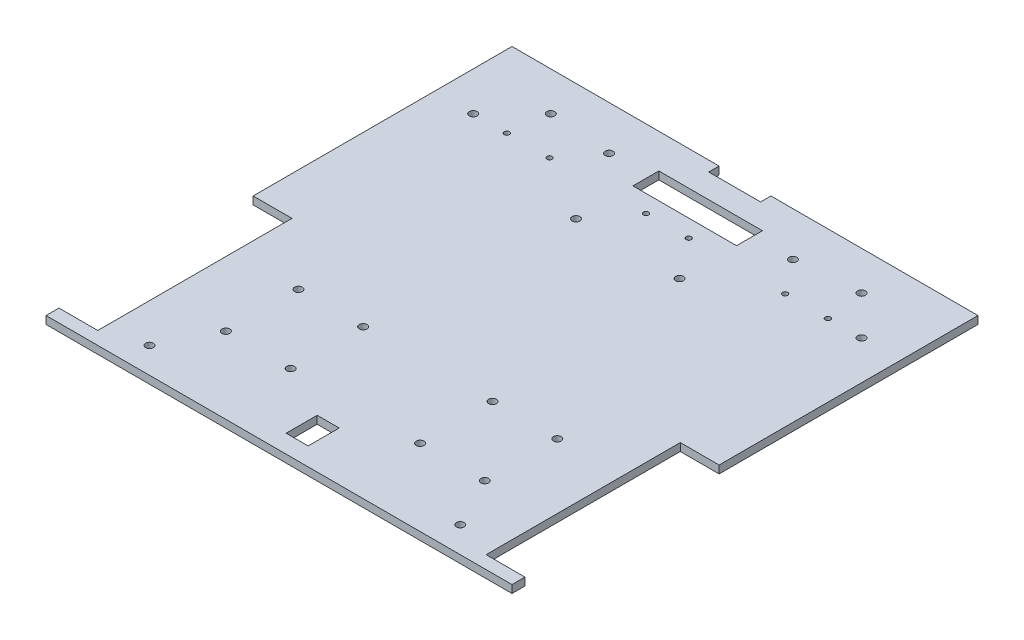
from build123d import *

# Parameters (mm, degrees)
SKETCH1_W           = 180
SKETCH1_H           = 180
BOSS_EXTRUDE1_DEPTH = 3
SKETCH2_W           = 15
SKETCH2_H           = 75
CUT_EXTRUDE1_DEPTH  = 3
SKETCH3_R           = 1.5
SKETCH3_R_2         = 1
SKETCH3_W           = 40
SKETCH3_H           = 10
CUT_EXTRUDE2_DEPTH  = 3
SKETCH5_R           = 1.5
CUT_EXTRUDE3_DEPTH  = 3
SKETCH7_W           = 20
SKETCH7_H           = 4
CUT_EXTRUDE4_DEPTH  = 3
SKETCH8_W           = 8.5
SKETCH8_H           = 12
CUT_EXTRUDE5_DEPTH  = 3


with BuildPart() as part:
    # Sketch1 → Boss-Extrude1 (new body)
    with BuildSketch(Plane(origin=(0, 0, 0), x_dir=(1, 0, 0), z_dir=(0, 1, 0))):
        Rectangle(SKETCH1_W, SKETCH1_H)
    extrude(amount=BOSS_EXTRUDE1_DEPTH)

    # Sketch2 → Cut-Extrude1 (cut)
    with BuildSketch(Plane(origin=(0, 3, 0), x_dir=(1, 0, 0), z_dir=(0, 1, 0))):
        with Locations((-82.5, -47.5)):
            Rectangle(SKETCH2_W, SKETCH2_H)
        with Locations((82.5, -47.5)):
            Rectangle(SKETCH2_W, SKETCH2_H)
    extrude(amount=-CUT_EXTRUDE1_DEPTH, mode=Mode.SUBTRACT)

    # Sketch3 → Cut-Extrude2 (cut)
    with BuildSketch(Plane(origin=(0, 3, 0), x_dir=(1, 0, 0), z_dir=(0, 1, 0))):
        with Locations(Location((-50, -32.5, 0), (0, 0, 270))):
            Circle(SKETCH3_R)
        with Locations(Location((-50, -60.5, 0), (0, 0, 270))):
            Circle(SKETCH3_R)
        with Locations(Location((-25, -32.5, 0), (0, 0, 270))):
            Circle(SKETCH3_R)
        with Locations(Location((-25, -60.5, 0), (0, 0, 270))):
            Circle(SKETCH3_R)
        with Locations(Location((25, -60.5, 0), (0, 0, 90))):
            Circle(SKETCH3_R)
        with Locations(Location((50, -60.5, 0), (0, 0, 90))):
            Circle(SKETCH3_R)
        with Locations(Location((25, -32.5, 0), (0, 0, 90))):
            Circle(SKETCH3_R)
        with Locations(Location((50, -32.5, 0), (0, 0, 90))):
            Circle(SKETCH3_R)
        with Locations(Location((-60, -80, 0), (0, 0, 270))):
            Circle(SKETCH3_R)
        with Locations(Location((60, -80, 0), (0, 0, 90))):
            Circle(SKETCH3_R)
        with Locations(Location((-62, 60, 0), (0, 0, 270))):
            Circle(SKETCH3_R_2)
        with Locations(Location((-45.5, 60, 0), (0, 0, 270))):
            Circle(SKETCH3_R_2)
        with Locations(Location((45.5, 60, 0), (0, 0, 90))):
            Circle(SKETCH3_R_2)
        with Locations(Location((62, 60, 0), (0, 0, 90))):
            Circle(SKETCH3_R_2)
        with Locations(Location((-60, 75, 0), (0, 0, 270))):
            Circle(SKETCH3_R)
        with Locations(Location((60, 75, 0), (0, 0, 90))):
            Circle(SKETCH3_R)
        with Locations(Location((-8.25, 60, 0), (0, 0, 270))):
            Circle(SKETCH3_R_2)
        with Locations(Location((8.25, 60, 0), (0, 0, 90))):
            Circle(SKETCH3_R_2)
        with Locations(Location((-20, 44.727497325, 0), (0, 0, 270))):
            Circle(SKETCH3_R)
        with Locations(Location((20, 44.727497325, 0), (0, 0, 90))):
            Circle(SKETCH3_R)
        with Locations((0, 71.727497325)):
            Rectangle(SKETCH3_W, SKETCH3_H)
    extrude(amount=-CUT_EXTRUDE2_DEPTH, mode=Mode.SUBTRACT)

    # Sketch5 → Cut-Extrude3 (cut)
    with BuildSketch(Plane(origin=(0, 3, 0), x_dir=(1, 0, 0), z_dir=(0, 1, 0))):
        with Locations(Location((-75, 60, 0), (0, 0, 270))):
            Circle(SKETCH5_R)
        with Locations(Location((75, 60, 0), (0, 0, 90))):
            Circle(SKETCH5_R)
        with Locations(Location((-35.5, 73, 0), (0, 0, 270))):
            Circle(SKETCH5_R)
        with Locations(Location((35.5, 73, 0), (0, 0, 90))):
            Circle(SKETCH5_R)
    extrude(amount=-CUT_EXTRUDE3_DEPTH, mode=Mode.SUBTRACT)

    # Sketch7 → Cut-Extrude4 (cut)
    with BuildSketch(Plane(origin=(0, 3, 0), x_dir=(1, 0, 0), z_dir=(0, 1, 0))):
        with Locations((0, 88)):
            Rectangle(SKETCH7_W, SKETCH7_H)
    extrude(amount=-CUT_EXTRUDE4_DEPTH, mode=Mode.SUBTRACT)

    # Sketch8 → Cut-Extrude5 (cut)
    with BuildSketch(Plane(origin=(0, 3, 0), x_dir=(1, 0, 0), z_dir=(0, 1, 0))):
        with Locations((0, -77)):
            Rectangle(SKETCH8_W, SKETCH8_H)
    extrude(amount=-CUT_EXTRUDE5_DEPTH, mode=Mode.SUBTRACT)


solid = part.part
